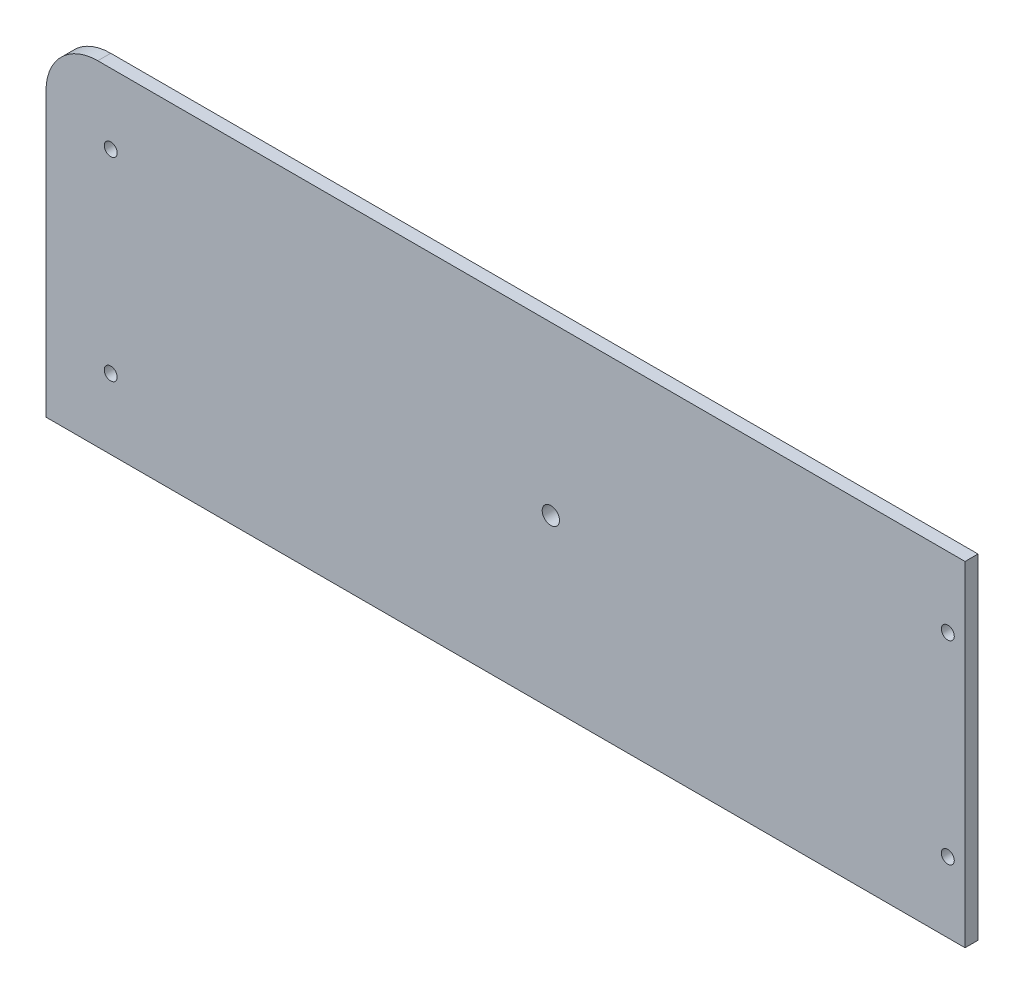
from build123d import *

# Parameters (mm, degrees)
SKETCH1_W           = 213
SKETCH1_H           = 77.54
BOSS_EXTRUDE1_DEPTH = 3
FILLET2_R           = 12
CUT_EXTRUDE1_REACH  = 115.377
SKETCH2_R           = 2
CUT_EXTRUDE2_REACH  = 115.377
SKETCH3_R           = 1.5
CUT_EXTRUDE3_REACH  = 115.377
SKETCH4_R           = 1.5


with BuildPart() as part:
    # Sketch1 → Boss-Extrude1 (new body)
    with BuildSketch(Plane.XY):
        Rectangle(SKETCH1_W, SKETCH1_H)
    extrude(amount=BOSS_EXTRUDE1_DEPTH)

    # Fillet2
    fillet2_edges = [part.edges().sort_by_distance(p)[0] for p in [
        (-106.5, 38.77, 1.5),
    ]]
    fillet(fillet2_edges, radius=FILLET2_R)

    # Sketch2 → Cut-Extrude1 (cut, up to next)
    with BuildSketch(Plane(origin=(0, 0, 0), x_dir=(-1, 0, 0), z_dir=(0, 0, -1)), mode=Mode.PRIVATE) as cut_extrude1_sk1:
        with Locations((-10.5, 0)):
            Circle(SKETCH2_R)
    cut_extrude1_tool1 = extrude(cut_extrude1_sk1.sketch, amount=-CUT_EXTRUDE1_REACH, mode=Mode.PRIVATE) & part.part
    add(cut_extrude1_tool1.solids().sort_by_distance((10.5, 0, 0))[0], mode=Mode.SUBTRACT)

    # Sketch3 → Cut-Extrude2 (cut, up to next)
    with BuildSketch(Plane(origin=(0, 0, 0), x_dir=(-1, 0, 0), z_dir=(0, 0, -1)), mode=Mode.PRIVATE) as cut_extrude2_sk1:
        with Locations((-102.5, 22.5)):
            Circle(SKETCH3_R)
    cut_extrude2_tool1 = extrude(cut_extrude2_sk1.sketch, amount=-CUT_EXTRUDE2_REACH, mode=Mode.PRIVATE) & part.part
    # Sketch3 → Cut-Extrude2 (cut, up to next)
    with BuildSketch(Plane(origin=(0, 0, 0), x_dir=(-1, 0, 0), z_dir=(0, 0, -1)), mode=Mode.PRIVATE) as cut_extrude2_sk2:
        with Locations((-102.5, -22.5)):
            Circle(SKETCH3_R)
    cut_extrude2_tool2 = extrude(cut_extrude2_sk2.sketch, amount=-CUT_EXTRUDE2_REACH, mode=Mode.PRIVATE) & part.part
    add(cut_extrude2_tool1.solids().sort_by_distance((102.5, 22.5, 0))[0], mode=Mode.SUBTRACT)
    add(cut_extrude2_tool2.solids().sort_by_distance((102.5, -22.5, 0))[0], mode=Mode.SUBTRACT)

    # Sketch4 → Cut-Extrude3 (cut, up to next)
    with BuildSketch(Plane(origin=(0, 0, 0), x_dir=(-1, 0, 0), z_dir=(0, 0, -1)), mode=Mode.PRIVATE) as cut_extrude3_sk1:
        with Locations((91.5, 22.5)):
            Circle(SKETCH4_R)
    cut_extrude3_tool1 = extrude(cut_extrude3_sk1.sketch, amount=-CUT_EXTRUDE3_REACH, mode=Mode.PRIVATE) & part.part
    # Sketch4 → Cut-Extrude3 (cut, up to next)
    with BuildSketch(Plane(origin=(0, 0, 0), x_dir=(-1, 0, 0), z_dir=(0, 0, -1)), mode=Mode.PRIVATE) as cut_extrude3_sk2:
        with Locations((91.5, -22.5)):
            Circle(SKETCH4_R)
    cut_extrude3_tool2 = extrude(cut_extrude3_sk2.sketch, amount=-CUT_EXTRUDE3_REACH, mode=Mode.PRIVATE) & part.part
    add(cut_extrude3_tool1.solids().sort_by_distance((-91.5, 22.5, 0))[0], mode=Mode.SUBTRACT)
    add(cut_extrude3_tool2.solids().sort_by_distance((-91.5, -22.5, 0))[0], mode=Mode.SUBTRACT)


solid = part.part
